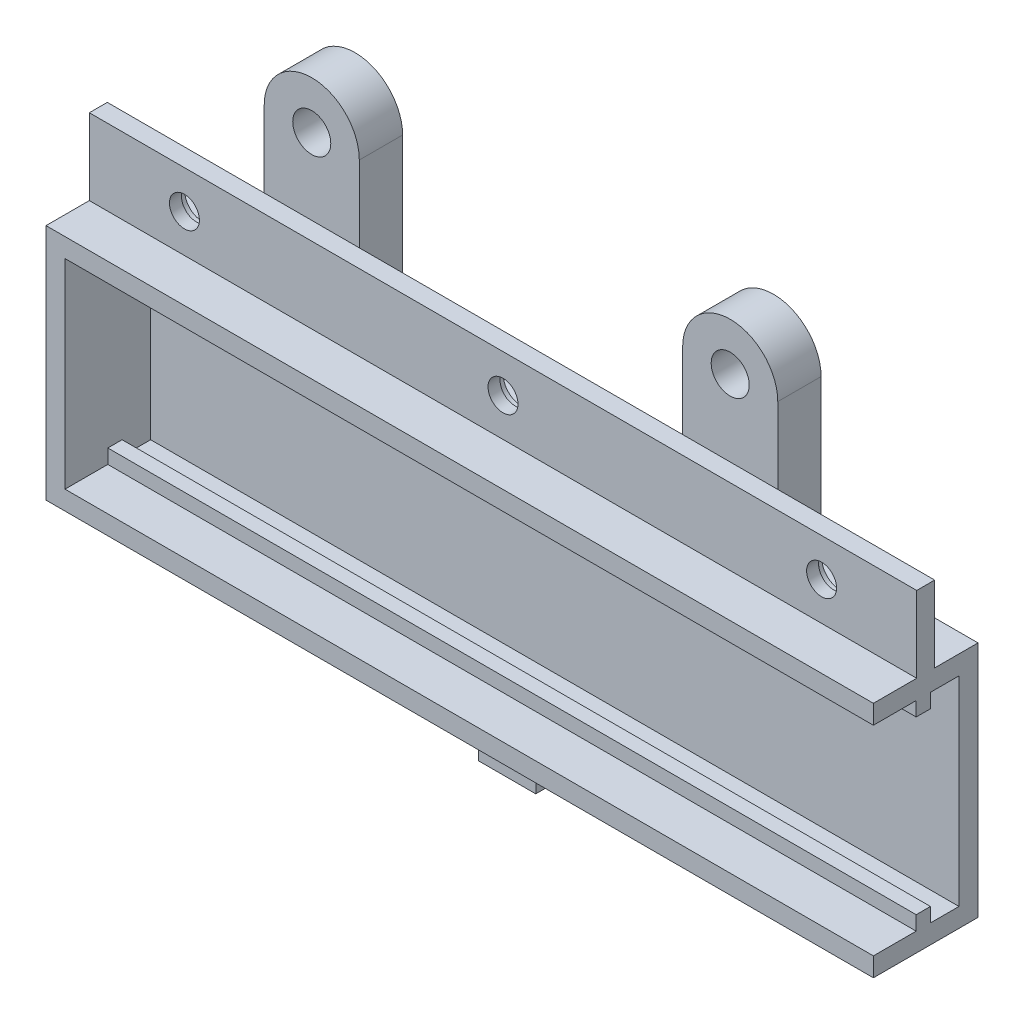
from build123d import *

# Parameters (mm, degrees)
SKETCH1_W           = 138.1125
SKETCH1_H           = 39.6875
SKETCH1_W_2         = 131.7625
SKETCH1_H_2         = 33.3375
BOSS_EXTRUDE1_DEPTH = 14.2875
SKETCH2_W           = 138.1125
SKETCH2_H           = 39.6875
BOSS_EXTRUDE2_DEPTH = 3.175
CUT_EXTRUDE1_REACH  = 142.26
SKETCH3_W           = 14.2875
SKETCH3_H           = 33.3375
BOSS_EXTRUDE3_REACH = 142.26
SKETCH4_W           = 2.38125
SKETCH4_H           = 2.38125
BOSS_EXTRUDE4_START = -8.73125
SKETCH6_W           = 138.1125
SKETCH6_H           = 12.7
SKETCH6_R           = 2.5
BOSS_EXTRUDE4_DEPTH = 1.5
SKETCH7_R           = 2.95
CUT_EXTRUDE2_DEPTH  = 1
SKETCH8_W           = 9.525
SKETCH8_H           = 9.525
BOSS_EXTRUDE5_DEPTH = 9.525
BOSS_EXTRUDE6_START = -10.23125
SKETCH9_W           = 15.875
SKETCH9_H           = 12.7
SKETCH9_R           = 3.175
BOSS_EXTRUDE6_DEPTH = 7.23125


with BuildPart() as part:
    # Sketch1 → Boss-Extrude1 (new body)
    with BuildSketch(Plane.XY):
        Rectangle(SKETCH1_W, SKETCH1_H)
        Rectangle(SKETCH1_W_2, SKETCH1_H_2, mode=Mode.SUBTRACT)
    extrude(amount=BOSS_EXTRUDE1_DEPTH)

    # Sketch2 → Boss-Extrude2 (add)
    with BuildSketch(Plane(origin=(0, 0, 0), x_dir=(-1, 0, 0), z_dir=(0, 0, -1))):
        Rectangle(SKETCH2_W, SKETCH2_H)
    extrude(amount=BOSS_EXTRUDE2_DEPTH)

    # Sketch3 → Cut-Extrude1 (cut, up to next)
    with BuildSketch(Plane(origin=(69.05625, 0, 0), x_dir=(0, 0, -1), z_dir=(1, 0, 0)), mode=Mode.PRIVATE) as cut_extrude1_sk1:
        with Locations((-7.14375, 0)):
            Rectangle(SKETCH3_W, SKETCH3_H)
    cut_extrude1_tool1 = extrude(cut_extrude1_sk1.sketch, amount=-CUT_EXTRUDE1_REACH, mode=Mode.PRIVATE) & part.part
    add(cut_extrude1_tool1.solids().sort_by_distance((69.05625, 0, 7.14375))[0], mode=Mode.SUBTRACT)

    # Sketch4 → Boss-Extrude3 (add, up to next)
    with BuildSketch(Plane(origin=(69.05625, 0, 0), x_dir=(0, 0, -1), z_dir=(1, 0, 0)), mode=Mode.PRIVATE) as boss_extrude3_sk1:
        with Locations((-5.953125, -15.478125)):
            Rectangle(SKETCH4_W, SKETCH4_H)
    boss_extrude3_tool1 = extrude(boss_extrude3_sk1.sketch, amount=-BOSS_EXTRUDE3_REACH, mode=Mode.PRIVATE) - part.part
    # Sketch4 → Boss-Extrude3 (add, up to next)
    with BuildSketch(Plane(origin=(69.05625, 0, 0), x_dir=(0, 0, -1), z_dir=(1, 0, 0)), mode=Mode.PRIVATE) as boss_extrude3_sk2:
        with Locations((-5.953125, 15.478125)):
            Rectangle(SKETCH4_W, SKETCH4_H)
    boss_extrude3_tool2 = extrude(boss_extrude3_sk2.sketch, amount=-BOSS_EXTRUDE3_REACH, mode=Mode.PRIVATE) - part.part
    add(boss_extrude3_tool1.solids().sort_by_distance((69.05625, -15.478125, 5.953125))[0])
    add(boss_extrude3_tool2.solids().sort_by_distance((69.05625, 15.478125, 5.953125))[0])

    # Sketch6 → Boss-Extrude4 (add, symmetric)
    with BuildSketch(Plane(origin=(0, 0, -3.175), x_dir=(-1, 0, 0), z_dir=(0, 0, -1)).offset(BOSS_EXTRUDE4_START)):
        with Locations((0, 26.19375)):
            Rectangle(SKETCH6_W, SKETCH6_H)
        with Locations((0, 26.19375)):
            Circle(SKETCH6_R, mode=Mode.SUBTRACT)
        with Locations((-53.18125, 26.19375)):
            Circle(SKETCH6_R, mode=Mode.SUBTRACT)
        with Locations((53.18125, 26.19375)):
            Circle(SKETCH6_R, mode=Mode.SUBTRACT)
    extrude(amount=BOSS_EXTRUDE4_DEPTH, both=True)

    # Sketch7 → Cut-Extrude2 (cut)
    with BuildSketch(Plane(origin=(0, 0, 4.05625), x_dir=(-1, 0, 0), z_dir=(0, 0, -1))):
        with Locations((-53.18125, 26.19375)):
            Circle(SKETCH7_R)
        with Locations((0, 26.19375)):
            Circle(SKETCH7_R)
        with Locations((53.18125, 26.19375)):
            Circle(SKETCH7_R)
    extrude(amount=-CUT_EXTRUDE2_DEPTH, mode=Mode.SUBTRACT)

    # Sketch8 → Boss-Extrude5 (add)
    with BuildSketch(Plane.XZ.offset(19.84375)):
        with Locations((0, 1.5875)):
            Rectangle(SKETCH8_W, SKETCH8_H)
    extrude(amount=BOSS_EXTRUDE5_DEPTH)

    # Sketch9 → Boss-Extrude6 (add)
    # profile 1 of 4: a face of its own
    with BuildSketch(Plane.XY.offset(7.05625).offset(BOSS_EXTRUDE6_START)):
        with Locations((-34.925, 26.19375)):
            Rectangle(SKETCH9_W, SKETCH9_H)
    # profile 2 of 4: a face of its own
    with BuildSketch(Plane.XY.offset(7.05625).offset(BOSS_EXTRUDE6_START)):
        with BuildLine():
            Line((-42.8625, 45.24375), (-42.8625, 32.54375))
            Line((-42.8625, 32.54375), (-26.9875, 32.54375))
            Line((-26.9875, 32.54375), (-26.9875, 45.24375))
            ThreePointArc((-26.9875, 45.24375), (-34.925, 53.18125), (-42.8625, 45.24375))
        make_face()
        with Locations(Location((-34.925, 45.24375, 0), (0, 0, 180))):
            Circle(SKETCH9_R, mode=Mode.SUBTRACT)
    # profile 3 of 4: a face of its own
    with BuildSketch(Plane.XY.offset(7.05625).offset(BOSS_EXTRUDE6_START)):
        with Locations((34.925, 26.19375)):
            Rectangle(SKETCH9_W, SKETCH9_H)
    # profile 4 of 4: a face of its own
    with BuildSketch(Plane.XY.offset(7.05625).offset(BOSS_EXTRUDE6_START)):
        with BuildLine():
            Line((26.9875, 45.24375), (26.9875, 32.54375))
            Line((26.9875, 32.54375), (42.8625, 32.54375))
            Line((42.8625, 32.54375), (42.8625, 45.24375))
            ThreePointArc((42.8625, 45.24375), (34.925, 53.18125), (26.9875, 45.24375))
        make_face()
        with Locations(Location((34.925, 45.24375, 0), (0, 0, 180))):
            Circle(SKETCH9_R, mode=Mode.SUBTRACT)
    extrude(amount=BOSS_EXTRUDE6_DEPTH)


solid = part.part
